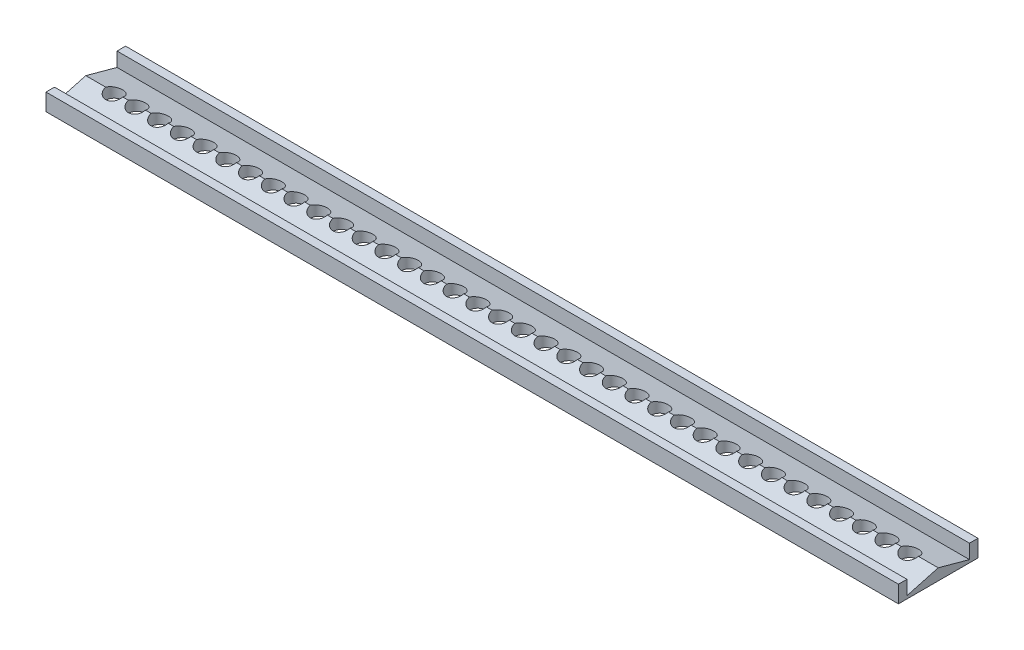
from build123d import *

# Parameters (mm, degrees)
BOSS_EXTRUDE1_DEPTH = 150
SKETCH3_R           = 1.5
CUT_EXTRUDE1_DEPTH  = 5
LPATTERN1_COUNT     = 36
LPATTERN1_PITCH     = 4


with BuildPart() as part:
    # Sketch2 → Boss-Extrude1 (new body)
    with BuildSketch(Plane(origin=(0, 0, 0), x_dir=(0, 0, -1), z_dir=(1, 0, 0))):
        Polygon((-7, -1.5), (7, -1.5), (7, 1.5), (5.5, 1.5), (5.5, -1), (0, 0.5), (-5.5, -1), (-5.5, 1.5), (-7, 1.5), align=None)
    extrude(amount=BOSS_EXTRUDE1_DEPTH)

    # Sketch3 → Cut-Extrude1 (cut)
    with BuildSketch(Plane.XZ.offset(1.5)):
        with Locations(Location((5, 0, 0), (0, 0, 270))):
            Circle(SKETCH3_R)
    cut_extrude1 = extrude(amount=-CUT_EXTRUDE1_DEPTH, mode=Mode.SUBTRACT)

    # LPattern1: Cut-Extrude1 ×36
    with Locations(*[(i * LPATTERN1_PITCH, 0, 0) for i in range(1, LPATTERN1_COUNT)]):
        add(cut_extrude1, mode=Mode.SUBTRACT)


solid = part.part
